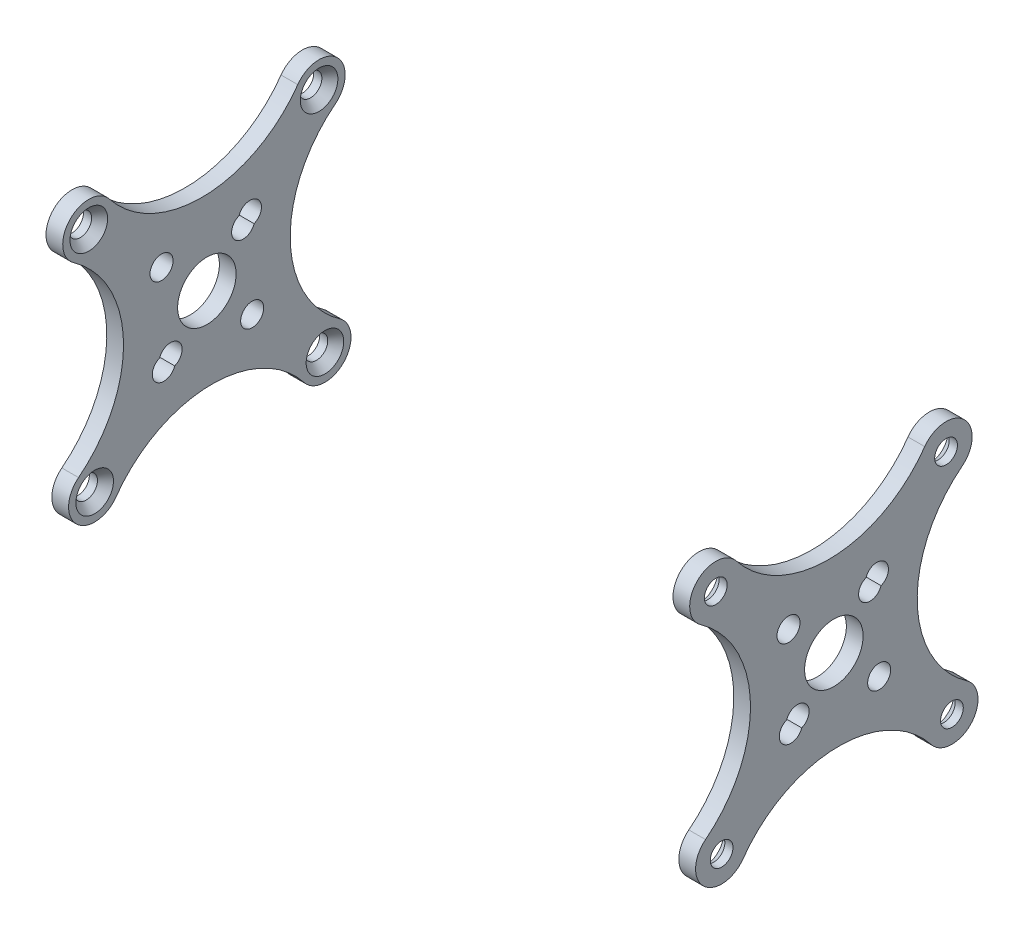
from build123d import *

# Parameters (mm, degrees)
SKETCH1_R                                     = 1.750000056
SKETCH1_R_2                                   = 4.445
BOSS_EXTRUDE1_DEPTH                           = 2.54
CSK_FOR_4_FLAT_HEAD_MACHINE_SCREW1_AT_2_COUNT = 2
CSK_FOR_4_FLAT_HEAD_MACHINE_SCREW1_AT_2_PITCH = 35.000000104
CSK_FOR_4_FLAT_HEAD_MACHINE_SCREW1_AT_3_COUNT = 2
CSK_FOR_4_FLAT_HEAD_MACHINE_SCREW1_AT_3_PITCH = 49.49747483
CSK_FOR_4_FLAT_HEAD_MACHINE_SCREW1_AT_4_COUNT = 2
CSK_FOR_4_FLAT_HEAD_MACHINE_SCREW1_AT_4_PITCH = 35.000000104
SKETCH4_R                                     = 1.75
CUT_EXTRUDE1_DEPTH                            = 2.54


with BuildPart() as part:
    # Sketch1 → Boss-Extrude1 (new body)
    with BuildSketch(Plane(origin=(48.9, 0, 0), x_dir=(0, 0, -1), z_dir=(1, 0, 0))):
        with BuildLine():
            ThreePointArc((-8.673656282, 14.105608673), (-8.390879103, 20.094619173), (-14.357715626, 19.507191211))
            ThreePointArc((-14.357715626, 19.507191211), (-28.491852405, 11.953104254), (-42.992373003, 18.777542299))
            ThreePointArc((-42.992373003, 18.777542299), (-48.981383503, 19.060319479), (-48.393955541, 13.093482955))
            ThreePointArc((-48.393955541, 13.093482955), (-40.839868584, -1.040653823), (-47.664306629, -15.541174421))
            ThreePointArc((-47.664306629, -15.541174421), (-47.947083809, -21.530184922), (-41.980247285, -20.94275696))
            ThreePointArc((-41.980247285, -20.94275696), (-27.846110507, -13.388670002), (-13.345589909, -20.213108048))
            ThreePointArc((-13.345589909, -20.213108048), (-7.356579408, -20.495885227), (-7.94400737, -14.529048704))
            ThreePointArc((-7.94400737, -14.529048704), (-15.498094328, -0.394911925), (-8.673656282, 14.105608673))
        make_face()
        with Locations((-33.679902761, -6.516898876)):
            Circle(SKETCH1_R, mode=Mode.SUBTRACT)
        with Locations((-35.055431743, 5.826436208)):
            Circle(SKETCH1_R, mode=Mode.SUBTRACT)
        with Locations((-21.282531169, -7.262001956)):
            Circle(SKETCH1_R, mode=Mode.SUBTRACT)
        with Locations((-22.658060151, 5.081333128)):
            Circle(SKETCH1_R, mode=Mode.SUBTRACT)
        with Locations((-28.168981456, -0.717782874)):
            Circle(SKETCH1_R_2, mode=Mode.SUBTRACT)
    extrude(amount=-BOSS_EXTRUDE1_DEPTH)

    # Sketch3 → CSK for #4 Flat Head Machine Screw1 (revolve, cut)
    with BuildSketch(Plane(origin=(46.36, 17.222317018, 11.120438424), x_dir=(0, 0, 1), z_dir=(0, 1, 0))):
        Polygon((0, 0), (0, 2.54), (1.7272, 2.54), (1.7272, 1.300261411), (2.8575, 0), align=None)
    csk_for_4_flat_head_machine_screw1 = revolve(axis=Axis((40.01, 17.222317018, 11.120438424), (1, 0, 0)), mode=Mode.SUBTRACT)

    # CSK for #4 Flat Head Machine Screw1 at 2: CSK for #4 Flat Head Machine Screw1 ×2
    with Locations(*[Vector(0, -0.02547305309288088, 0.9996755091359032) * (i * CSK_FOR_4_FLAT_HEAD_MACHINE_SCREW1_AT_2_PITCH) for i in range(1, CSK_FOR_4_FLAT_HEAD_MACHINE_SCREW1_AT_2_COUNT)]):
        add(csk_for_4_flat_head_machine_screw1, mode=Mode.SUBTRACT)

    # CSK for #4 Flat Head Machine Screw1 at 3: CSK for #4 Flat Head Machine Screw1 ×2
    with Locations(*[Vector(0, -0.7248895000756126, 0.6888651629166107) * (i * CSK_FOR_4_FLAT_HEAD_MACHINE_SCREW1_AT_3_PITCH) for i in range(1, CSK_FOR_4_FLAT_HEAD_MACHINE_SCREW1_AT_3_COUNT)]):
        add(csk_for_4_flat_head_machine_screw1, mode=Mode.SUBTRACT)

    # CSK for #4 Flat Head Machine Screw1 at 4: CSK for #4 Flat Head Machine Screw1 ×2
    with Locations(*[Vector(0, -0.9996755091359032, -0.025473053092881035) * (i * CSK_FOR_4_FLAT_HEAD_MACHINE_SCREW1_AT_4_PITCH) for i in range(1, CSK_FOR_4_FLAT_HEAD_MACHINE_SCREW1_AT_4_COUNT)]):
        add(csk_for_4_flat_head_machine_screw1, mode=Mode.SUBTRACT)

    # Sketch4 → Cut-Extrude1 (cut)
    with BuildSketch(Plane(origin=(48.9, 0, 0), x_dir=(0, 0, -1), z_dir=(1, 0, 0))):
        with Locations((-34.713200504, -7.604233125)):
            Circle(SKETCH4_R)
        with Locations((-21.624762408, 6.168667377)):
            Circle(SKETCH4_R)
    extrude(amount=-CUT_EXTRUDE1_DEPTH, mode=Mode.SUBTRACT)


with BuildPart() as body_2:
    # Mirror1: mirrored copy
    add(part.part.mirror(Plane(origin=(0, 0, 0), x_dir=(0, 0, 1), z_dir=(1, 0, 0))))


solid = Compound([part.part, body_2.part])
